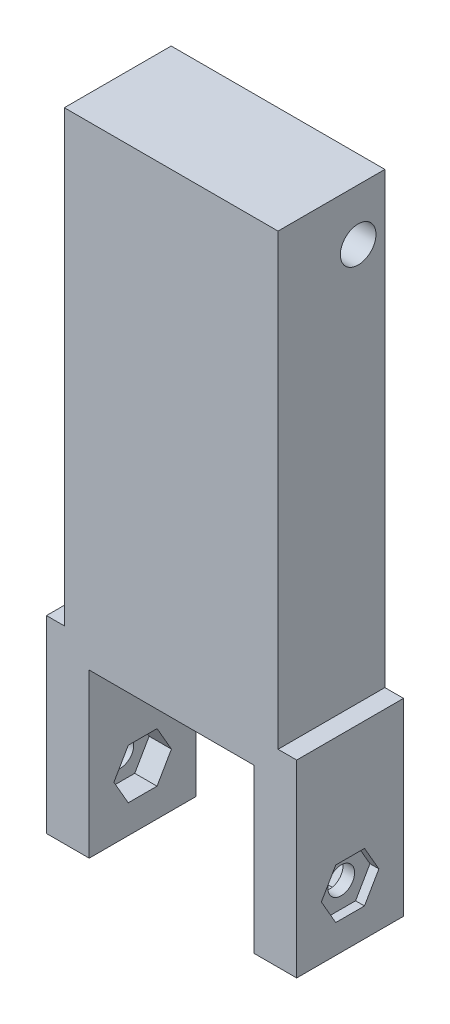
from build123d import *

# Parameters (mm, degrees)
EXTRUDE_1_DEPTH      = 12
CUT_EXTRUDE_12_DEPTH = 1
CUT_EXTRUDE_13_DEPTH = 1
CUT_EXTRUDE_14_DEPTH = 2.5
CUT_EXTRUDE_16_DEPTH = 2.5
SKETCH_26_R          = 1.5
CUT_EXTRUDE_17_DEPTH = 54.695511127
SKETCH_27_R          = 2
CUT_EXTRUDE_18_DEPTH = 54.151469748


with BuildPart() as part:
    # 스케치1 → 보스-돌출1 (new body)
    with BuildSketch(Plane.XY):
        Polygon((-11.994395335, 44.774969809), (-11.994395335, -5.625030191), (-13.999795062, -5.625030191), (-13.999795062, -26.825030191), (-9.199795062, -26.825030191), (-9.199795062, -8.525030191), (9.300204823, -8.527085749), (9.300204823, -26.827085749), (14.100204823, -26.827085749), (14.100204823, -5.627085749), (12.005604665, -5.627085749), (12.005604665, 44.774969809), align=None)
    extrude(amount=EXTRUDE_1_DEPTH)

    # 스케치20 → 컷-돌출12 (cut)
    with BuildSketch(Plane(origin=(14.100204823, 0, 0), x_dir=(0, 0, -1), z_dir=(1, 0, 0))):
        Polygon((-4.384999641, -23.626174282), (-7.614999641, -23.626174282), (-9.228415158, -20.82434965), (-7.61341897, -18.03073805), (-4.380259285, -18.03073805), (-2.768420518, -20.829824529), align=None)
    extrude(amount=-CUT_EXTRUDE_12_DEPTH, mode=Mode.SUBTRACT)

    # 스케치21 → 컷-돌출13 (cut)
    with BuildSketch(Plane.ZY.offset(13.999795062)):
        Polygon((7.611839128, -23.624116045), (4.381839128, -23.624116045), (2.768423611, -20.822291413), (4.383419799, -18.028679813), (7.616579484, -18.028679813), (9.228418251, -20.827766292), align=None)
    extrude(amount=-CUT_EXTRUDE_13_DEPTH, mode=Mode.SUBTRACT)

    # 스케치22 → 컷-돌출14 (cut)
    with BuildSketch(Plane.ZY.offset(-9.300204823)):
        Polygon((7.615000359, -23.624118724), (4.385000359, -23.624118724), (2.771584842, -20.822294093), (4.38658103, -18.028682492), (7.619740715, -18.028682492), (9.231579482, -20.827768971), align=None)
    extrude(amount=-CUT_EXTRUDE_14_DEPTH, mode=Mode.SUBTRACT)

    # 스케치25 → 컷-돌출16 (cut)
    with BuildSketch(Plane(origin=(-9.199795062, 0, 0), x_dir=(0, 0, -1), z_dir=(1, 0, 0))):
        Polygon((-4.384999641, -23.626174282), (-7.614999641, -23.626174282), (-9.228415158, -20.82434965), (-7.61341897, -18.03073805), (-4.380259285, -18.03073805), (-2.768420518, -20.829824529), align=None)
    extrude(amount=-CUT_EXTRUDE_16_DEPTH, mode=Mode.SUBTRACT)

    # 스케치26 → 컷-돌출17 (cut, through all)
    with BuildSketch(Plane.ZY.offset(12.999795062)):
        with Locations((6, -20.825030191)):
            Circle(SKETCH_26_R)
    extrude(amount=-CUT_EXTRUDE_17_DEPTH, mode=Mode.SUBTRACT)

    # 스케치27 → 컷-돌출18 (cut, through all)
    with BuildSketch(Plane(origin=(12.005604665, 0, 0), x_dir=(0, 0, -1), z_dir=(1, 0, 0))):
        with Locations(Location((-3, 38.972914251, 0), (0, 0, 90))):
            Circle(SKETCH_27_R)
    extrude(amount=-CUT_EXTRUDE_18_DEPTH, mode=Mode.SUBTRACT)


solid = part.part
